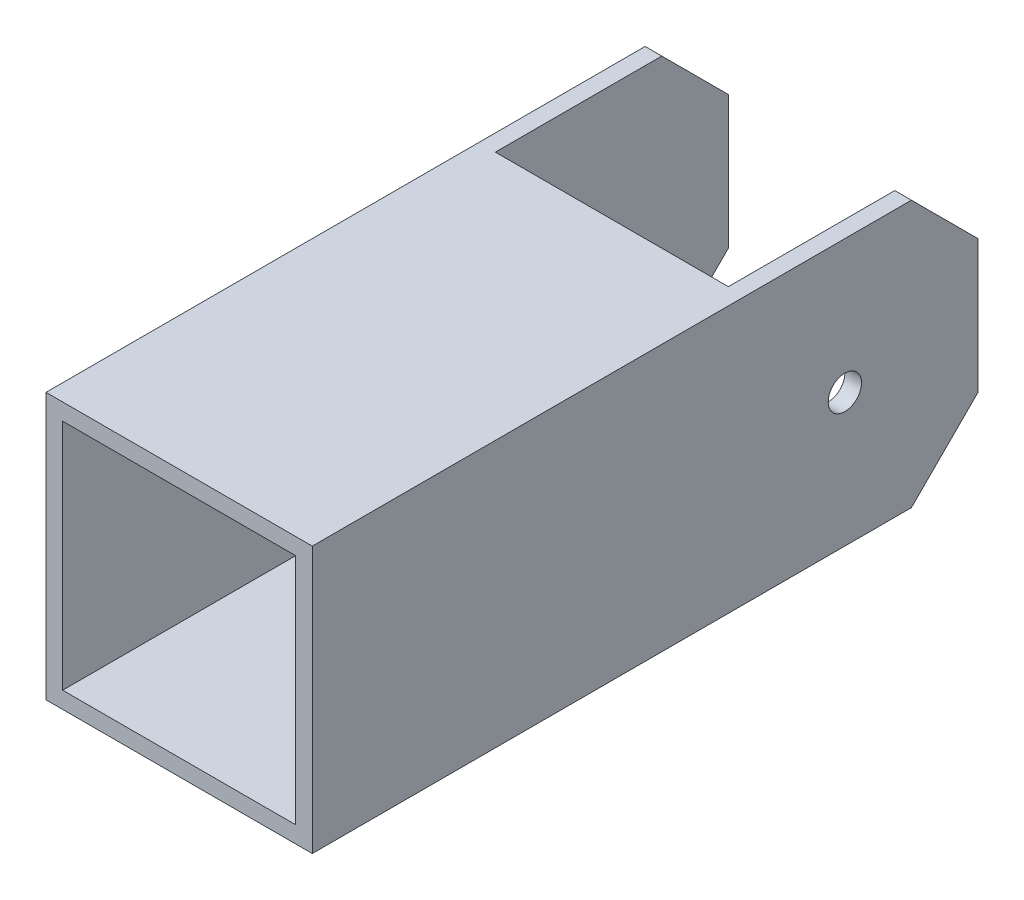
from build123d import *

# Parameters (mm, degrees)
SKETCH2_W           = 50.8
SKETCH2_H           = 50.8
SKETCH2_W_2         = 44.45
SKETCH2_H_2         = 44.45
BOSS_EXTRUDE1_DEPTH = 127
SKETCH3_R           = 3.175
CUT_EXTRUDE1_DEPTH  = 140.121529606
SKETCH5_W           = 44.45
SKETCH5_H           = 44.45
CUT_EXTRUDE2_DEPTH  = 140.121529606
CHAMFER1_SIZE       = 12.7


with BuildPart() as part:
    # Sketch2 → Boss-Extrude1 (new body)
    with BuildSketch(Plane.XY):
        Rectangle(SKETCH2_W, SKETCH2_H)
        Rectangle(SKETCH2_W_2, SKETCH2_H_2, mode=Mode.SUBTRACT)
    extrude(amount=BOSS_EXTRUDE1_DEPTH)

    # Sketch3 → Cut-Extrude1 (cut, through all)
    with BuildSketch(Plane.ZY.offset(25.4)):
        with Locations((25.4, 0)):
            Circle(SKETCH3_R)
    extrude(amount=-CUT_EXTRUDE1_DEPTH, mode=Mode.SUBTRACT)

    # Sketch5 → Cut-Extrude2 (cut, through all)
    with BuildSketch(Plane(origin=(0, 25.4, 0), x_dir=(1, 0, 0), z_dir=(0, 1, 0))):
        with Locations((0, -22.225)):
            Rectangle(SKETCH5_W, SKETCH5_H)
    extrude(amount=-CUT_EXTRUDE2_DEPTH, mode=Mode.SUBTRACT)

    # Chamfer1
    chamfer1_edges = [part.edges().sort_by_distance(p)[0] for p in [
        (23.8125, -25.4, 0),
        (-23.8125, 25.4, 0),
        (-23.8125, -25.4, 0),
        (23.8125, 25.4, 0),
    ]]
    chamfer(chamfer1_edges, length=CHAMFER1_SIZE)


solid = part.part
